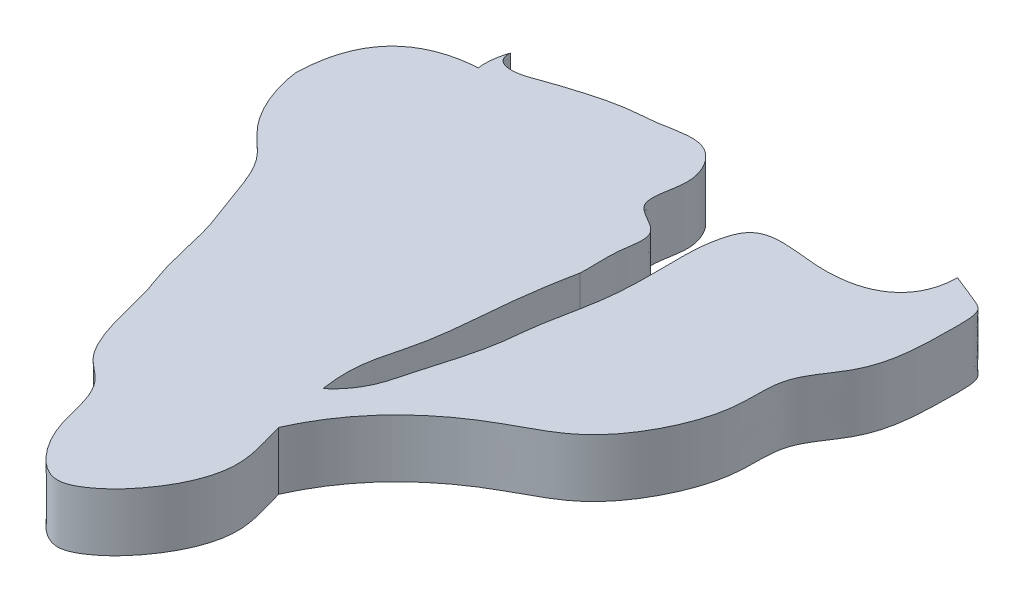
from build123d import *

# Parameters (mm, degrees)
BOSS_EXTRUDE1_DEPTH = 15


with BuildPart() as part:
    # Sketch1 → Boss-Extrude1 (new body)
    with BuildSketch(Plane(origin=(0, 0, 0), x_dir=(1, 0, 0), z_dir=(0, 1, 0))):
        with BuildLine():
            add(Edge.make_bspline(
                [(47.420375472, 177.719365279), (47.145041997, 174.571270337), (51.808266467, 173.360392084), (58.516800003, 175.988264579), (66.529402506, 178.560886227), (74.675889393, 180.59161246), (83.638862203, 180.930288074), (93.902439439, 184.369053507), (101.590112285, 172.298935737), (95.358769398, 160.020471882), (107.883313291, 156.83605583), (105.171638753, 146.495919028), (105.945825946, 141.078138074), (105.757273733, 137.419894275)],
                knots=[0.001604008, 0.001604008, 0.001604008, 0.001604008, 0.068049885, 0.126734755, 0.221277447, 0.325872867, 0.379657996, 0.499723597, 0.610693351, 0.730784057, 0.814836596, 0.893690288, 1, 1, 1, 1], degree=3))
            add(Edge.make_bspline(
                [(46.571971641, 170.254393227), (46.093863053, 173.527762887), (47.420375472, 177.719365279)],
                knots=[0.884490367, 0.884490367, 0.884490367, 0.968241419, 0.968241419, 0.968241419], degree=2))
            add(Edge.make_bspline(
                [(24.037514039, 145.517039337), (24.615355613, 168.822282866), (46.571971641, 170.254393227)],
                knots=[0, 0, 0, 1, 1, 1], degree=2))
            add(Edge.make_bspline(
                [(24.037514039, 145.517039337), (24.262193341, 143.639002283), (25.417126955, 138.13476126), (30.007706349, 128.357618332), (39.799149221, 121.115164184), (43.212879708, 110.146291015), (48.655011635, 97.057373026), (49.967287218, 86.727943744), (54.645986215, 75.411140051), (57.593504204, 57.548820676), (72.352035983, 47.851599968), (69.140361711, 35.824975137), (81.048923957, 23.103025259), (84.954156509, 23.374845148)],
                knots=[0.084882791, 0.084882791, 0.084882791, 0.084882791, 0.107769948, 0.154078141, 0.187829052, 0.232552433, 0.269709292, 0.335228905, 0.347596967, 0.388301803, 0.400297277, 0.462463604, 0.490432201, 0.490432201, 0.490432201, 0.490432201], degree=3))
            add(Edge.make_bspline(
                [(84.954156509, 23.374845148), (86.724444495, 23.49806431), (91.461000977, 26.08455689), (99.359972931, 34.145982919), (106.459091674, 48.055249871), (102.659441034, 59.013545199), (101.451104278, 63.420679881), (101.354801018, 63.779360992)],
                knots=[0.490432201, 0.490432201, 0.490432201, 0.490432201, 0.503110696, 0.523547212, 0.568461378, 0.596541232, 0.599029787, 0.599029787, 0.599029787, 0.599029787], degree=3))
            add(Edge.make_bspline(
                [(101.354801018, 63.779360992), (100.489289336, 67.002955825), (99.457419916, 71.752464986), (98.594714989, 76.646173878), (98.371173911, 78.231708436)],
                knots=[0.599029787, 0.599029787, 0.599029787, 0.599029787, 0.621395322, 0.632065867, 0.632065867, 0.632065867, 0.632065867], degree=3))
            add(Edge.make_bspline(
                [(98.371173911, 78.231708436), (97.919327158, 81.436571947), (97.382407557, 89.07479991), (101.802241125, 102.143245912), (102.790355639, 119.297508142), (104.336005259, 130.446896526), (105.753591562, 137.401839946), (105.757273733, 137.419894275)],
                knots=[0.632065867, 0.632065867, 0.632065867, 0.632065867, 0.653634391, 0.683152646, 0.723780599, 0.766209008, 0.766319387, 0.766319387, 0.766319387, 0.766319387], degree=3))
        make_face()
        with BuildLine():
            add(Edge.make_bspline(
                [(155.713820159, 185.222032492), (155.425874835, 173.100712353), (140.483266869, 166.904105138), (118.936964383, 172.612470356), (115.192644125, 160.330308288), (115.3482681, 149.617652952), (115.444629092, 134.450964327), (112.045371199, 122.272000915), (110.825170091, 106.919954458), (107.256011137, 97.098479499), (104.28720935, 85.057124746), (101.326801423, 80.620711931), (98.371173911, 78.231708436)],
                knots=[0, 0, 0, 0, 0.208504743, 0.326502314, 0.372956542, 0.455666883, 0.565002653, 0.694719851, 0.729433596, 0.891839378, 0.917522653, 1, 1, 1, 1], degree=3))
            add(Edge.make_bspline(
                [(101.354801018, 63.779360992), (100.489289336, 67.002955825), (99.457419916, 71.752464986), (98.594714989, 76.646173878), (98.371173911, 78.231708436)],
                knots=[0.599029787, 0.599029787, 0.599029787, 0.599029787, 0.621395322, 0.632065867, 0.632065867, 0.632065867, 0.632065867], degree=3))
            add(Edge.make_bspline(
                [(101.354801018, 63.779360992), (107.117832886, 76.721656316), (120.473418612, 89.897431044), (142.317546651, 99.806909703), (151.76308069, 112.717182702), (156.680083839, 127.20808173), (155.026379864, 140.767224007), (165.947395909, 153.380172539), (166.472728829, 165.379777078), (166.475511991, 181.771898827), (162.78223802, 182.245817734), (155.713820159, 185.222032492)],
                knots=[0, 0, 0, 0, 0.265263995, 0.365208211, 0.471003715, 0.57544875, 0.659468452, 0.752228069, 0.920297925, 0.960402116, 1, 1, 1, 1], degree=3))
        make_face()
    extrude(amount=BOSS_EXTRUDE1_DEPTH)


solid = part.part
